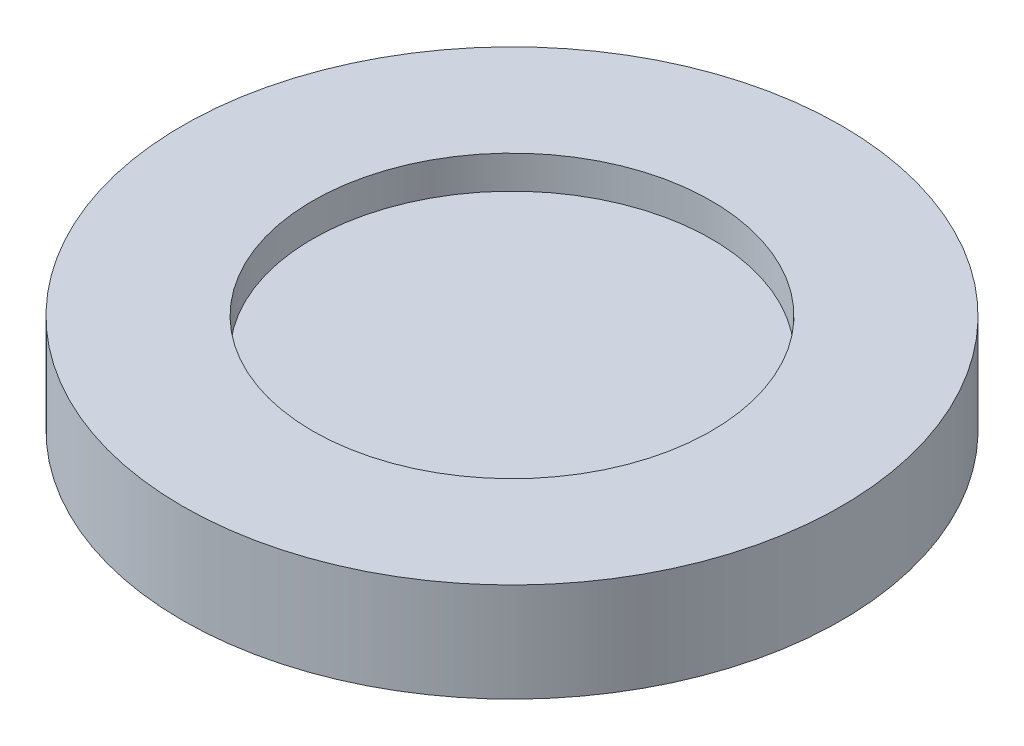
from build123d import *

# Parameters (mm, degrees)
SKETCH_1_R          = 10
EXTRUDE_1_DEPTH     = 3
SKETCH_2_R          = 6.05
CUT_EXTRUDE_1_DEPTH = 1


with BuildPart() as part:
    # 草图1 → 凸台-拉伸1 (new body)
    with BuildSketch(Plane(origin=(0, 0, 0), x_dir=(1, 0, 0), z_dir=(0, 1, 0))):
        with Locations(Location((0, 0, 0), (0, 0, 270))):
            Circle(SKETCH_1_R)
    extrude(amount=EXTRUDE_1_DEPTH)

    # 草图2 → 切除-拉伸1 (cut)
    with BuildSketch(Plane(origin=(0, 3, 0), x_dir=(1, 0, 0), z_dir=(0, 1, 0))):
        with Locations(Location((0, 0, 0), (0, 0, 270))):
            Circle(SKETCH_2_R)
    extrude(amount=-CUT_EXTRUDE_1_DEPTH, mode=Mode.SUBTRACT)


solid = part.part
